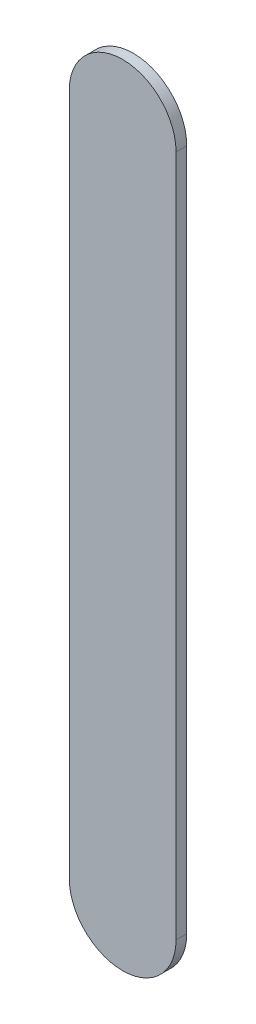
from build123d import *

# Parameters (mm, degrees)
BOSS_EXTRUDE1_DEPTH = 1


with BuildPart() as part:
    # Sketch1 → Boss-Extrude1 (new body)
    with BuildSketch(Plane.XY):
        with BuildLine():
            Line((-5, 0), (-5, 63.9))
            ThreePointArc((-5, 63.9), (0, 68.9), (5, 63.9))
            Line((5, 63.9), (5, 0))
            ThreePointArc((5, 0), (0, -5), (-5, 0))
        make_face()
    extrude(amount=BOSS_EXTRUDE1_DEPTH)


solid = part.part
